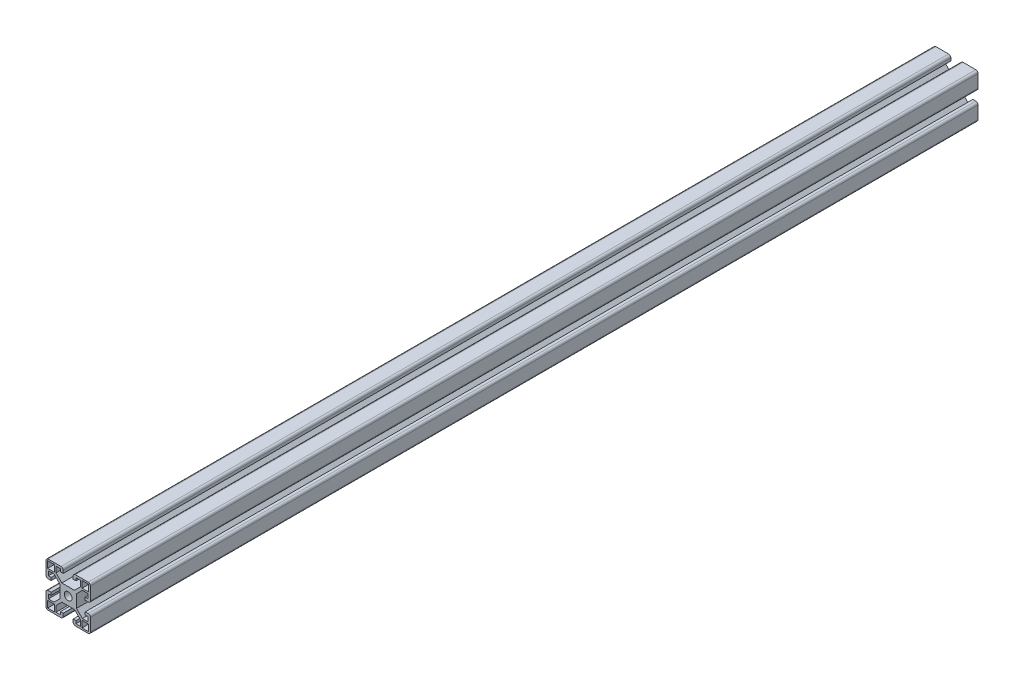
from build123d import *

# Parameters (mm, degrees)
CROQUIS1_W              = 40
CROQUIS1_H              = 40
SALIENTE_EXTRUIR1_DEPTH = 800
CROQUIS2_W              = 6
CROQUIS2_H              = 6
CROQUIS2_R              = 3.5
CORTAR_EXTRUIR2_DEPTH   = 800
REDONDEO1_R             = 2
REDONDEO2_R             = 2


with BuildPart() as part:
    # Croquis1 → Saliente-Extruir1 (new body)
    with BuildSketch(Plane.XY):
        Rectangle(CROQUIS1_W, CROQUIS1_H)
    extrude(amount=SALIENTE_EXTRUIR1_DEPTH)

    # Croquis2 → Cortar-Extruir2 (cut)
    with BuildSketch(Plane.XY.offset(800)):
        with Locations((-15.5, 15.5)):
            Rectangle(CROQUIS2_W, CROQUIS2_H)
        Polygon((4.5, 15.5), (4.5, 20), (-4.5, 20), (-4.5, 15.5), (-7, 15.5), (-7, 18), (-11, 18), (-11, 12.767766953), (-5.733637236, 7.501404189), (5.733637236, 7.501404189), (11, 12.767766953), (11, 18), (7, 18), (7, 15.5), align=None)
        with Locations((15.5, 15.5)):
            Rectangle(CROQUIS2_W, CROQUIS2_H)
        Polygon((15.367588592, -4.5), (20, -4.5), (20, 4.5), (15.367588592, 4.5), (15.367588592, 7), (17.867588592, 7), (17.867588592, 11), (12.767766953, 11), (7.501349817, 5.733582864), (7.501349817, -5.733582864), (12.767766953, -11), (17.867588592, -11), (17.867588592, -7), (15.367588592, -7), align=None)
        Polygon((-20, 4.5), (-20, -4.5), (-15.367588592, -4.5), (-15.367588592, -7), (-17.867588592, -7), (-17.867588592, -11), (-12.767766953, -11), (-7.501349817, -5.733582864), (-7.501349817, 5.733582864), (-12.767766953, 11), (-17.867588592, 11), (-17.867588592, 7), (-15.367588592, 7), (-15.367588592, 4.5), align=None)
        Circle(CROQUIS2_R)
        Polygon((11, -12.767766953), (5.733637236, -7.501404189), (-5.733637236, -7.501404189), (-11, -12.767766953), (-11, -18), (-7, -18), (-7, -15.5), (-4.5, -15.5), (-4.5, -20), (4.5, -20), (4.5, -15.5), (7, -15.5), (7, -18), (11, -18), align=None)
        with Locations((-15.5, -15.5)):
            Rectangle(CROQUIS2_W, CROQUIS2_H)
        with Locations((15.5, -15.5)):
            Rectangle(CROQUIS2_W, CROQUIS2_H)
    extrude(amount=-CORTAR_EXTRUIR2_DEPTH, mode=Mode.SUBTRACT)

    # Redondeo1
    redondeo1_edges = [part.edges().sort_by_distance(p)[0] for p in [
        (20, -20, 400),
        (-20, -20, 400),
        (-20, 20, 400),
        (20, 20, 400),
    ]]
    fillet(redondeo1_edges, radius=REDONDEO1_R)

    # Redondeo2
    redondeo2_edges = [part.edges().sort_by_distance(p)[0] for p in [
        (4.5, 20, 400),
        (-4.5, 20, 400),
        (20, -4.5, 400),
        (20, 4.5, 400),
        (-20, 4.5, 400),
        (-20, -4.5, 400),
        (-4.5, -20, 400),
        (4.5, -20, 400),
    ]]
    fillet(redondeo2_edges, radius=REDONDEO2_R)


solid = part.part
